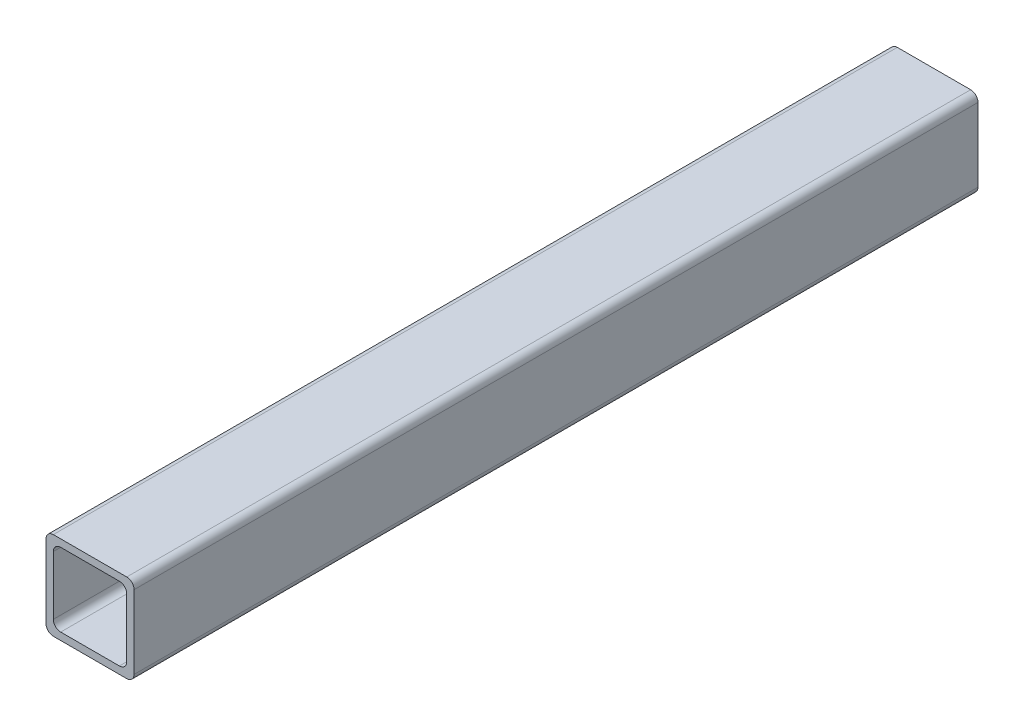
from build123d import *

# Parameters (mm, degrees)
BOSS_EXTRUDE1_DEPTH = 575
SKETCH2_R           = 8.5
CUT_EXTRUDE1_DEPTH  = 10


with BuildPart() as part:
    # Sketch1 → Boss-Extrude1 (new, symmetric)
    with BuildSketch(Plane.XY):
        with BuildLine():
            Line((-50, -60), (50, -60))
            ThreePointArc((50, -60), (57.071067812, -57.071067812), (60, -50))
            Line((60, -50), (60, 50))
            ThreePointArc((60, 50), (57.071067812, 57.071067812), (50, 60))
            Line((50, 60), (-50, 60))
            ThreePointArc((-50, 60), (-57.071067812, 57.071067812), (-60, 50))
            Line((-60, 50), (-60, -50))
            ThreePointArc((-60, -50), (-57.071067812, -57.071067812), (-50, -60))
        make_face()
        with BuildLine():
            Line((-40, -50), (40, -50))
            ThreePointArc((40, -50), (47.071067812, -47.071067812), (50, -40))
            Line((50, -40), (50, 40))
            ThreePointArc((50, 40), (47.071067812, 47.071067812), (40, 50))
            Line((40, 50), (-40, 50))
            ThreePointArc((-40, 50), (-47.071067812, 47.071067812), (-50, 40))
            Line((-50, 40), (-50, -40))
            ThreePointArc((-50, -40), (-47.071067812, -47.071067812), (-40, -50))
        make_face(mode=Mode.SUBTRACT)
    extrude(amount=BOSS_EXTRUDE1_DEPTH, both=True)

    # Sketch2 → Cut-Extrude1 (cut)
    with BuildSketch(Plane.XZ.offset(60)):
        with Locations(Location((0, 501, 0), (0, 0, 270))):
            Circle(SKETCH2_R)
        with Locations(Location((0, -501, 0), (0, 0, 90))):
            Circle(SKETCH2_R)
    extrude(amount=-CUT_EXTRUDE1_DEPTH, mode=Mode.SUBTRACT)


solid = part.part
